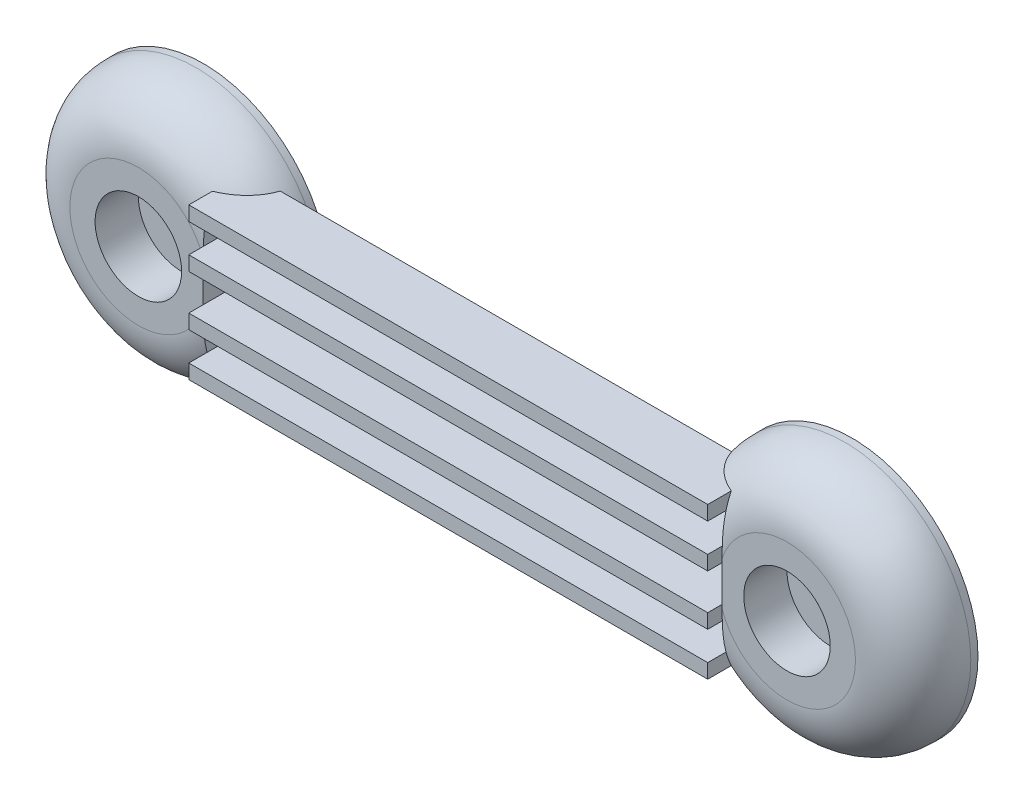
from build123d import *

# Parameters (mm, degrees)
CROQUIS1_R                = 17.5
SALIENTE_EXTRUIR1_DEPTH   = 9
SALIENTE_EXTRUIR1_2_DEPTH = 9
REDONDEO1_R               = 8
REDONDEO2_R               = 8
CROQUIS5_W                = 72
CROQUIS5_H                = 21
SALIENTE_EXTRUIR2_DEPTH   = 8
CROQUIS6_W                = 72
CROQUIS6_H                = 4
CROQUIS6_H_2              = 5
CORTAR_EXTRUIR1_DEPTH     = 7
CROQUIS8_R                = 6
CORTAR_EXTRUIR2_DEPTH     = 6
CROQUIS9_R                = 2.5
CORTAR_EXTRUIR3_DEPTH     = 66.394954068


with BuildPart() as part:
    # Croquis1 → Saliente-Extruir1 (new body)
    with BuildSketch(Plane.XY):
        with Locations((45, 0)):
            Circle(CROQUIS1_R)
    extrude(amount=SALIENTE_EXTRUIR1_DEPTH)

    # Redondeo2
    redondeo2_edges = [part.edges().sort_by_distance(p)[0] for p in [
        (27.5, 0, 9),
    ]]
    fillet(redondeo2_edges, radius=REDONDEO2_R)



with BuildPart() as body_2:
    # Croquis1 → Saliente-Extruir1 2 (new body)
    with BuildSketch(Plane.XY):
        with Locations((-45, 0)):
            Circle(CROQUIS1_R)
    extrude(amount=SALIENTE_EXTRUIR1_2_DEPTH)

    # Redondeo1
    redondeo1_edges = [body_2.edges().sort_by_distance(p)[0] for p in [
        (-62.5, 0, 9),
    ]]
    fillet(redondeo1_edges, radius=REDONDEO1_R)


with BuildPart() as part_1:
    add(part.part)

    add(body_2.part)  # Saliente-Extruir2 merges body 2
    # Croquis5 → Saliente-Extruir2 (add)
    with BuildSketch(Plane.XY.offset(3)):
        Rectangle(CROQUIS5_W, CROQUIS5_H)
    extrude(amount=SALIENTE_EXTRUIR2_DEPTH)

    # Croquis6 → Cortar-Extruir1 (cut)
    with BuildSketch(Plane.XY.offset(11)):
        with Locations((0, 6.5)):
            Rectangle(CROQUIS6_W, CROQUIS6_H)
        Rectangle(CROQUIS6_W, CROQUIS6_H_2)
        with Locations((0, -6.5)):
            Rectangle(CROQUIS6_W, CROQUIS6_H)
    extrude(amount=-CORTAR_EXTRUIR1_DEPTH, mode=Mode.SUBTRACT)

    # Croquis8 → Cortar-Extruir2 (cut)
    with BuildSketch(Plane.XY.offset(9)):
        with Locations((-45, 0)):
            Circle(CROQUIS8_R)
        with Locations((45, 0)):
            Circle(CROQUIS8_R)
    extrude(amount=-CORTAR_EXTRUIR2_DEPTH, mode=Mode.SUBTRACT)

    # Croquis9 → Cortar-Extruir3 (cut, through all)
    with BuildSketch(Plane.XY.offset(3)):
        with Locations((45, 0)):
            Circle(CROQUIS9_R)
        with Locations((-45, 0)):
            Circle(CROQUIS9_R)
    extrude(amount=-CORTAR_EXTRUIR3_DEPTH, mode=Mode.SUBTRACT)


solid = part_1.part
